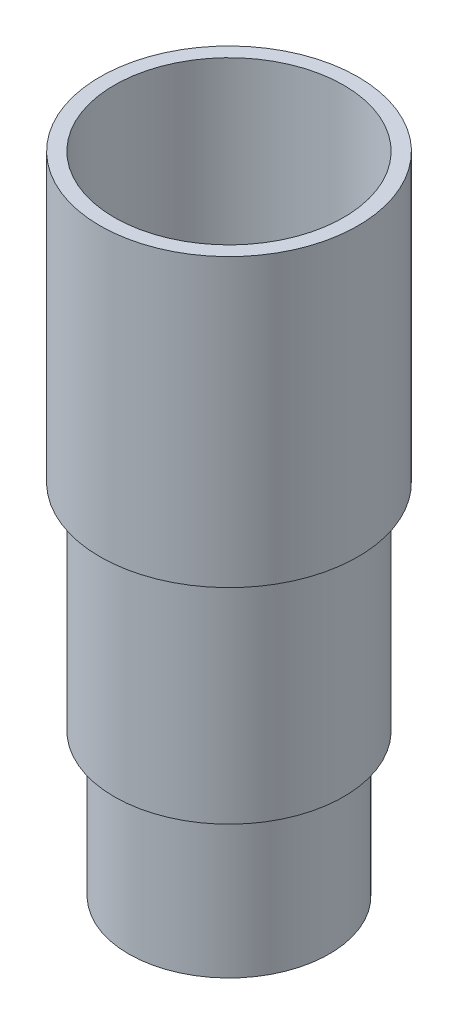
from build123d import *

# Parameters (mm, degrees)
SKETCH1_R           = 15.24
SKETCH1_W           = 20.32
SKETCH1_H           = 12.7
BOSS_EXTRUDE1_DEPTH = 6.35
SKETCH2_R           = 17.78
SKETCH2_R_2         = 15.24
BOSS_EXTRUDE2_DEPTH = 25.4
SKETCH5_R           = 20.32
SKETCH5_R_2         = 17.78
BOSS_EXTRUDE3_DEPTH = 38.1
SKETCH6_R           = 22.86
SKETCH6_R_2         = 20.32
BOSS_EXTRUDE4_DEPTH = 50.8


with BuildPart() as part:
    # Sketch1 → Boss-Extrude1 (new body)
    with BuildSketch(Plane(origin=(0, 0, 0), x_dir=(1, 0, 0), z_dir=(0, 1, 0))):
        with Locations(Location((0, 0, 0), (0, 0, 270))):
            Circle(SKETCH1_R)
        Rectangle(SKETCH1_W, SKETCH1_H, mode=Mode.SUBTRACT)
    extrude(amount=BOSS_EXTRUDE1_DEPTH)

    # Sketch2 → Boss-Extrude2 (add)
    with BuildSketch(Plane(origin=(0, 0, 0), x_dir=(1, 0, 0), z_dir=(0, 1, 0))):
        with Locations(Location((0, 0, 0), (0, 0, 270))):
            Circle(SKETCH2_R)
        with Locations(Location((0, 0, 0), (0, 0, 270))):
            Circle(SKETCH2_R_2, mode=Mode.SUBTRACT)
    extrude(amount=BOSS_EXTRUDE2_DEPTH)


with BuildPart() as body_2:
    # Sketch5 → Boss-Extrude3 (new body)
    with BuildSketch(Plane(origin=(0, 25.4, 0), x_dir=(1, 0, 0), z_dir=(0, 1, 0))):
        with Locations(Location((0, 0, 0), (0, 0, 90))):
            Circle(SKETCH5_R)
        with Locations(Location((0, 0, 0), (0, 0, 90))):
            Circle(SKETCH5_R_2, mode=Mode.SUBTRACT)
    extrude(amount=BOSS_EXTRUDE3_DEPTH)


with BuildPart() as body_3:
    # Sketch6 → Boss-Extrude4 (new body)
    with BuildSketch(Plane(origin=(0, 63.5, 0), x_dir=(1, 0, 0), z_dir=(0, 1, 0))):
        with Locations(Location((0, 0, 0), (0, 0, 270))):
            Circle(SKETCH6_R)
        with Locations(Location((0, 0, 0), (0, 0, 270))):
            Circle(SKETCH6_R_2, mode=Mode.SUBTRACT)
    extrude(amount=BOSS_EXTRUDE4_DEPTH)


solid = Compound([part.part, body_2.part, body_3.part])
